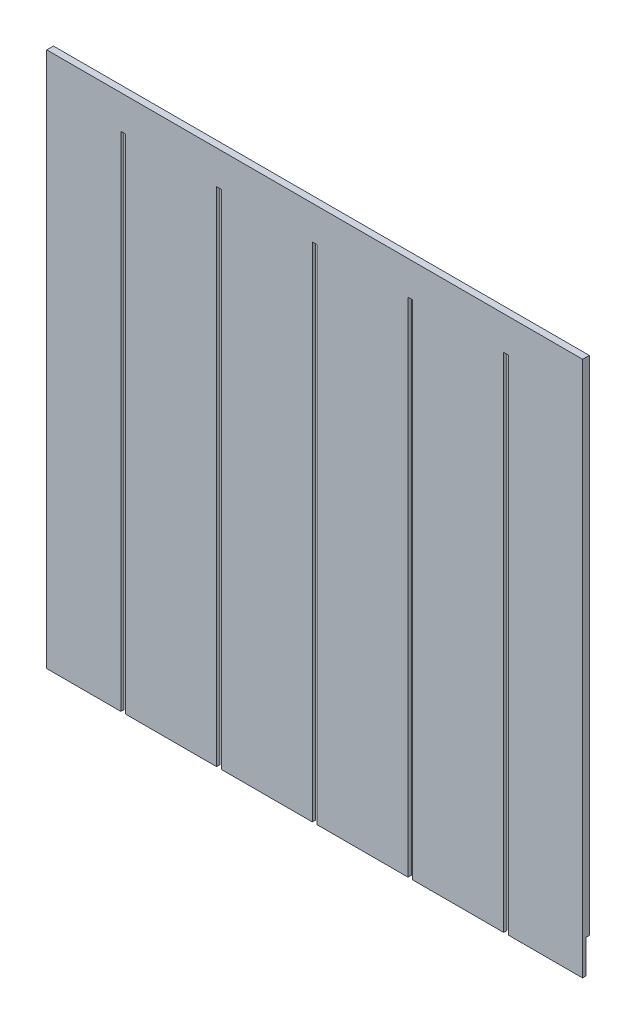
from build123d import *

# Parameters (mm, degrees)
EXTRUDE_2_DEPTH = 1
EXTRUDE_3_DEPTH = 1


with BuildPart() as part:
    # 草图1 → 凸台-拉伸2 (new body)
    with BuildSketch(Plane.XY):
        Polygon((-57.86, -80), (-57.86, 70), (-56.46, 70), (-56.46, -80), (-34.28, -80), (-29.28, -80), (-29.28, 70), (-27.88, 70), (-27.88, -80), (-5.7, -80), (-0.7, -80), (-0.7, 70), (0.7, 70), (0.7, -80), (22.88, -80), (27.88, -80), (27.88, 70), (29.28, 70), (29.28, -80), (51.46, -80), (56.46, -80), (56.46, 70), (57.86, 70), (57.86, -80), (80, -80), (80, 80), (-80, 80), (-80, -80), (-62.86, -80), align=None)
    extrude(amount=EXTRUDE_2_DEPTH)

    # 草图2 → 凸台-拉伸3 (add)
    with BuildSketch(Plane(origin=(0, 0, 0), x_dir=(-1, 0, 0), z_dir=(0, 0, -1))):
        Polygon((-80, -70), (-77.5, -70), (-77.5, -67.5), (-72.5, -67.5), (-72.5, -70), (-70, -70), (-70, 70), (72.5, 70), (72.5, 72.5), (77.5, 72.5), (77.5, 70), (80, 70), (80, 80), (-80, 80), align=None)
    extrude(amount=EXTRUDE_3_DEPTH)


solid = part.part
